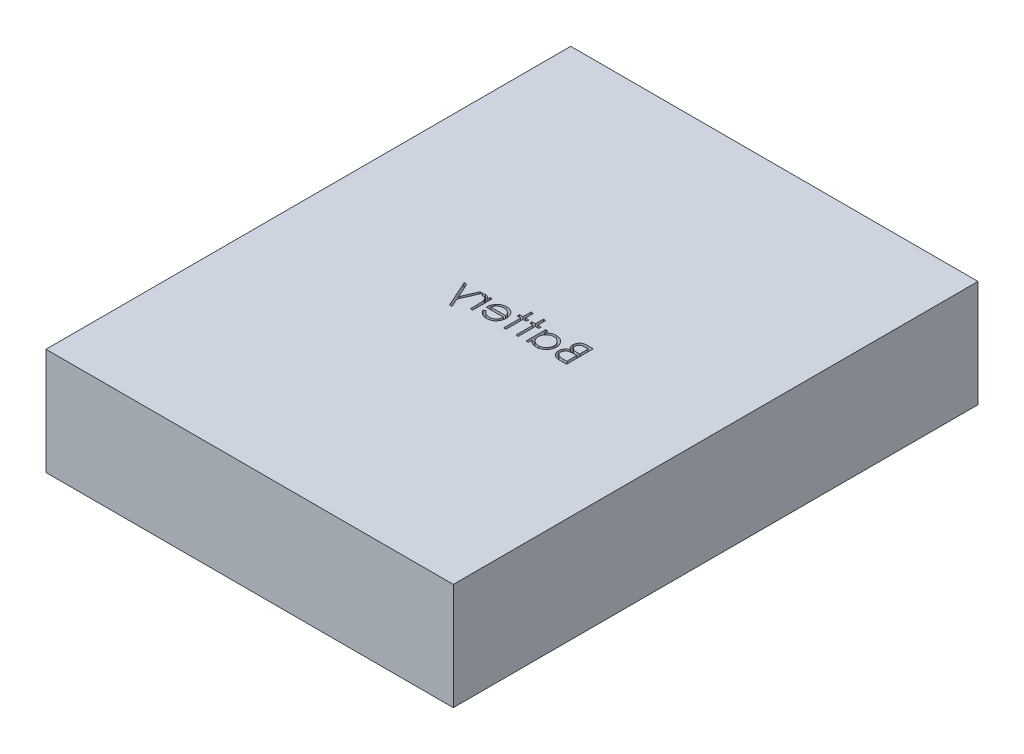
from build123d import *

# Parameters (mm, degrees)
SKETCH1_W           = 53.4
SKETCH1_H           = 68.8
BOSS_EXTRUDE1_DEPTH = 14
CUT_EXTRUDE8_DEPTH  = 15


with BuildPart() as part:
    # Sketch1 → Boss-Extrude1 (new body)
    with BuildSketch(Plane(origin=(0, 0, 0), x_dir=(1, 0, 0), z_dir=(0, 1, 0))):
        with Locations((26.7, 34.4)):
            Rectangle(SKETCH1_W, SKETCH1_H)
    extrude(amount=BOSS_EXTRUDE1_DEPTH)

    # Sketch10 → Cut-Extrude8 (cut, symmetric)
    # profile 1 of 7: a face of its own
    with BuildSketch(Plane(origin=(0, 0, 0), x_dir=(-1, 0, 0), z_dir=(0, -1, 0))):
        with BuildLine():
            Line((-35.827007514, 35.925623616), (-35.144114886, 35.925623616))
            add(Edge.make_bspline(
                [(-35.144114886, 35.925623616), (-35.110686407, 35.925447866), (-35.045893697, 35.925107218), (-34.951674255, 35.919824086), (-34.863425445, 35.912620417), (-34.781121672, 35.901190324), (-34.70480097, 35.887398547), (-34.634233333, 35.870696731), (-34.56964316, 35.850670117), (-34.492530424, 35.818823836), (-34.404609763, 35.771500667), (-34.30941137, 35.701572102), (-34.228007131, 35.616039639), (-34.157820814, 35.519556984), (-34.102019694, 35.413421212), (-34.061650397, 35.300162023), (-34.036092522, 35.181240281), (-34.033464087, 35.099597103), (-34.032135719, 35.058335956)],
                knots=[0, 0, 0, 0, 1.001505555, 1.941167018, 2.826882275, 3.653841531, 4.429895133, 5.150066043, 5.825578002, 6.45369114, 7.647487171, 8.808567382, 9.977351308, 11.170798116, 12.373658725, 13.556498008, 14.765093433, 16, 16, 16, 16], degree=3))
            add(Edge.make_bspline(
                [(-34.032135719, 35.058335956), (-34.033228937, 35.0196834), (-34.035377215, 34.943727483), (-34.055919974, 34.832633374), (-34.088080643, 34.726882155), (-34.132785892, 34.626859769), (-34.190887888, 34.534826156), (-34.259746207, 34.45003889), (-34.342823009, 34.376087833), (-34.405066249, 34.334744931), (-34.436682995, 34.31374461)],
                knots=[0, 0, 0, 0, 1.044552857, 2.05264487, 3.044412934, 4.028983338, 5.005914585, 5.980388656, 6.974128949, 8, 8, 8, 8], degree=3))
            add(Edge.make_bspline(
                [(-34.436682995, 34.31374461), (-34.396922567, 34.298479611), (-34.32085102, 34.269273886), (-34.216165007, 34.217638422), (-34.125970162, 34.161476312), (-34.049573016, 34.100144462), (-33.984235361, 34.034035651), (-33.92718242, 33.962180537), (-33.878501046, 33.883641779), (-33.836788122, 33.799238243), (-33.804239366, 33.709831775), (-33.779863462, 33.616260999), (-33.765896013, 33.518861444), (-33.763908371, 33.452576064), (-33.76290495, 33.419113199)],
                knots=[0, 0, 0, 0, 1.27268992, 2.434971085, 3.483601985, 4.442670788, 5.356604649, 6.2567628, 7.179492994, 8.113709626, 9.066344395, 10.018646069, 10.999752585, 12, 12, 12, 12], degree=3))
            add(Edge.make_bspline(
                [(-33.76290495, 33.419113199), (-33.763881796, 33.384946327), (-33.765803768, 33.317722049), (-33.77998374, 33.218966915), (-33.803992847, 33.124591968), (-33.837063993, 33.033986785), (-33.880226307, 32.947326651), (-33.932754272, 32.864513387), (-33.995385835, 32.786379056), (-34.065448704, 32.712055433), (-34.14471085, 32.645227646), (-34.230226605, 32.585711939), (-34.323072925, 32.536765877), (-34.421724919, 32.495649855), (-34.527289235, 32.464242657), (-34.639291842, 32.442270083), (-34.757636144, 32.427465046), (-34.838845895, 32.426247841), (-34.880493091, 32.425623616)],
                knots=[0, 0, 0, 0, 0.978564426, 1.925352924, 2.850884081, 3.763762016, 4.682927383, 5.618979971, 6.567305752, 7.547517671, 8.540179244, 9.531824382, 10.526200242, 11.540722885, 12.589160233, 13.674978461, 14.80764778, 16, 16, 16, 16], degree=3))
            Line((-34.880493091, 32.425623616), (-35.827007514, 32.425623616))
            Line((-35.827007514, 32.425623616), (-35.827007514, 35.925623616))
        make_face()
        with BuildLine():
            Line((-35.51290495, 35.566649257), (-35.51290495, 34.444854385))
            Line((-35.51290495, 34.444854385), (-35.30186729, 34.444854385))
            add(Edge.make_bspline(
                [(-35.30186729, 34.444854385), (-35.271018494, 34.445254308), (-35.211412335, 34.446027041), (-35.125092438, 34.448240558), (-35.04496742, 34.454438601), (-34.971175587, 34.460634863), (-34.903833143, 34.470709451), (-34.843089282, 34.482701574), (-34.787990685, 34.495384479), (-34.724451139, 34.516953966), (-34.652378191, 34.548831641), (-34.575545087, 34.598303477), (-34.507810617, 34.657227831), (-34.450613429, 34.725218792), (-34.403801959, 34.800084978), (-34.371288244, 34.880631859), (-34.349240959, 34.964851991), (-34.347249428, 35.022670243), (-34.346238283, 35.05202586)],
                knots=[0, 0, 0, 0, 1.156816544, 2.235205308, 3.236616184, 4.169592532, 5.011045266, 5.787822928, 6.49130361, 7.128639758, 8.301311294, 9.436451833, 10.541879658, 11.654887649, 12.756523258, 13.837046038, 14.901820046, 16, 16, 16, 16], degree=3))
            add(Edge.make_bspline(
                [(-34.346238283, 35.05202586), (-34.346764463, 35.071451631), (-34.347796623, 35.109557403), (-34.356249926, 35.165106757), (-34.3706175, 35.21735051), (-34.389071793, 35.26700462), (-34.414860482, 35.31251647), (-34.445223945, 35.355459666), (-34.481909636, 35.394371785), (-34.523666948, 35.430741283), (-34.571675571, 35.462985811), (-34.625906863, 35.491226574), (-34.68709454, 35.513967351), (-34.754207395, 35.533883503), (-34.828278483, 35.547871797), (-34.908453036, 35.559525184), (-34.995387755, 35.565457926), (-35.055532858, 35.566243289), (-35.086622899, 35.566649257)],
                knots=[0, 0, 0, 0, 0.91205012, 1.789085906, 2.630437955, 3.453916878, 4.269457761, 5.079663411, 5.91843418, 6.774407191, 7.675494373, 8.627863946, 9.638891023, 10.736472738, 11.911756761, 13.175263542, 14.539845004, 16, 16, 16, 16], degree=3))
            Line((-35.086622899, 35.566649257), (-35.51290495, 35.566649257))
        make_face(mode=Mode.SUBTRACT)
        with BuildLine():
            Line((-35.51290495, 34.085880026), (-35.51290495, 32.784597975))
            Line((-35.51290495, 32.784597975), (-35.065589245, 32.784597975))
            add(Edge.make_bspline(
                [(-35.065589245, 32.784597975), (-35.033570319, 32.784981722), (-34.97185806, 32.785721345), (-34.88275683, 32.788135899), (-34.800173726, 32.793628175), (-34.724485591, 32.802274025), (-34.654875138, 32.811652474), (-34.592177435, 32.824263755), (-34.535884241, 32.838712715), (-34.470609934, 32.861046888), (-34.397106425, 32.895743359), (-34.317895569, 32.948057585), (-34.247469351, 33.010380893), (-34.187664092, 33.082511807), (-34.138651103, 33.160943134), (-34.102995648, 33.244088484), (-34.081004791, 33.330574011), (-34.078342622, 33.389540724), (-34.077007514, 33.419113199)],
                knots=[0, 0, 0, 0, 1.160039823, 2.235823828, 3.228722157, 4.157150951, 4.99529583, 5.772374946, 6.472645482, 7.099169577, 8.269452708, 9.405989375, 10.527446681, 11.663510218, 12.788923519, 13.866172445, 14.929861265, 16, 16, 16, 16], degree=3))
            add(Edge.make_bspline(
                [(-34.077007514, 33.419113199), (-34.077283618, 33.43760654), (-34.077831373, 33.474294922), (-34.086091988, 33.528210741), (-34.098105858, 33.580436614), (-34.113637292, 33.631114355), (-34.136256759, 33.679327731), (-34.162663304, 33.72603029), (-34.193624706, 33.77128377), (-34.241868872, 33.828496023), (-34.312040856, 33.894413036), (-34.411747631, 33.958950539), (-34.525119929, 34.010998346), (-34.607347422, 34.033097822), (-34.64982402, 34.04451384)],
                knots=[0, 0, 0, 0, 0.723448775, 1.435228256, 2.130040452, 2.821711965, 3.505591119, 4.210454504, 4.921174351, 5.648778258, 7.137944449, 8.670945889, 10.280296675, 12, 12, 12, 12], degree=3))
            add(Edge.make_bspline(
                [(-34.64982402, 34.04451384), (-34.666853116, 34.047968924), (-34.703775708, 34.055460259), (-34.763983289, 34.063367962), (-34.832719158, 34.070413022), (-34.910142035, 34.07562418), (-34.996349876, 34.081010723), (-35.091526795, 34.083105545), (-35.19528411, 34.085604805), (-35.267276482, 34.085785939), (-35.304671777, 34.085880026)],
                knots=[0, 0, 0, 0, 0.634451884, 1.375622551, 2.216452059, 3.157844607, 4.20941857, 5.370758133, 6.634282058, 8, 8, 8, 8], degree=3))
            Line((-35.304671777, 34.085880026), (-35.51290495, 34.085880026))
        make_face(mode=Mode.SUBTRACT)
    # profile 2 of 7: a face of its own
    with BuildSketch(Plane(origin=(0, 0, 0), x_dir=(-1, 0, 0), z_dir=(0, -1, 0))):
        with BuildLine():
            Line((-30.532135719, 34.983315924), (-30.532135719, 32.425623616))
            Line((-30.532135719, 32.425623616), (-30.846238283, 32.425623616))
            Line((-30.846238283, 32.425623616), (-30.846238283, 32.868031469))
            add(Edge.make_bspline(
                [(-30.846238283, 32.868031469), (-30.881657074, 32.827991875), (-30.950777289, 32.749854103), (-31.066218407, 32.647771931), (-31.188586585, 32.563393609), (-31.317287906, 32.495243694), (-31.452206149, 32.444051637), (-31.593042237, 32.407665478), (-31.739853618, 32.384271643), (-31.840105972, 32.381935621), (-31.890909757, 32.380751821)],
                knots=[0, 0, 0, 0, 1.074387032, 2.096679803, 3.090159297, 4.057316773, 5.018401886, 5.985159533, 6.978961417, 8, 8, 8, 8], degree=3))
            add(Edge.make_bspline(
                [(-31.890909757, 32.380751821), (-31.936077711, 32.381978193), (-32.025150916, 32.384396654), (-32.156179993, 32.403158957), (-32.282272243, 32.433289579), (-32.403546815, 32.475190469), (-32.519218961, 32.53077129), (-32.630279058, 32.597312538), (-32.73615175, 32.676553368), (-32.835223289, 32.767141397), (-32.926455289, 32.865536384), (-33.006516562, 32.970481931), (-33.073269641, 33.081524235), (-33.129089722, 33.197257388), (-33.172086067, 33.318572308), (-33.202059701, 33.445049476), (-33.220800147, 33.576539349), (-33.223217608, 33.666078873), (-33.224443411, 33.711480988)],
                knots=[0, 0, 0, 0, 1.033919861, 2.038935746, 3.024066025, 3.998881131, 4.97069526, 5.957263378, 6.95902576, 7.993208707, 9.027059324, 10.027763471, 11.009749337, 11.988697705, 12.965288445, 13.950418724, 14.960734635, 16, 16, 16, 16], degree=3))
            add(Edge.make_bspline(
                [(-33.224443411, 33.711480988), (-33.22319044, 33.755944691), (-33.220713383, 33.843847035), (-33.202260163, 33.973125733), (-33.171229155, 34.097643993), (-33.127681307, 34.217000937), (-33.071839352, 34.331340987), (-33.003911265, 34.440745012), (-32.92389214, 34.545514409), (-32.831639733, 34.643185636), (-32.731704963, 34.73340625), (-32.624796232, 34.811815296), (-32.513572951, 34.879532145), (-32.39630994, 34.933185621), (-32.274742836, 34.976594725), (-32.14778939, 35.006627694), (-32.015977811, 35.024325015), (-31.926487319, 35.026887779), (-31.881094052, 35.028187719)],
                knots=[0, 0, 0, 0, 1.020392517, 2.01726096, 2.990465484, 3.961182959, 4.928053699, 5.906110375, 6.912531644, 7.948652711, 8.985773172, 9.998621852, 10.987621588, 11.969261332, 12.953316658, 13.946091881, 14.958173133, 16, 16, 16, 16], degree=3))
            add(Edge.make_bspline(
                [(-31.881094052, 35.028187719), (-31.828894193, 35.026749967), (-31.726532733, 35.023930604), (-31.576804724, 35.000467877), (-31.435160246, 34.96082941), (-31.300505894, 34.906911912), (-31.173325208, 34.835263182), (-31.054822224, 34.744883221), (-30.94375674, 34.636342034), (-30.879376449, 34.55297159), (-30.846238283, 34.510058712)],
                knots=[0, 0, 0, 0, 1.038897134, 2.037228247, 3.008116434, 3.962042015, 4.918381754, 5.904844433, 6.921570401, 8, 8, 8, 8], degree=3))
            Line((-30.846238283, 34.510058712), (-30.846238283, 34.983315924))
            Line((-30.846238283, 34.983315924), (-30.532135719, 34.983315924))
        make_face()
        with BuildLine():
            add(Edge.make_bspline(
                [(-31.876887322, 34.714085154), (-31.922801659, 34.712451517), (-32.013429259, 34.709226976), (-32.146473261, 34.68405348), (-32.273786676, 34.642168886), (-32.39473275, 34.584886985), (-32.507400966, 34.512858248), (-32.608094637, 34.425736865), (-32.697637339, 34.325899851), (-32.772945603, 34.21379774), (-32.8343361, 34.093619649), (-32.877503132, 33.967995211), (-32.905972379, 33.839190234), (-32.9088809, 33.751827548), (-32.910340847, 33.707975379)],
                knots=[0, 0, 0, 0, 1.031046209, 2.035121221, 3.029706178, 4.034933723, 5.034054252, 6.02443088, 7.017295772, 8.038157696, 9.050218397, 10.03989886, 11.016116709, 12, 12, 12, 12], degree=3))
            add(Edge.make_bspline(
                [(-32.910340847, 33.707975379), (-32.908475954, 33.664385272), (-32.904753477, 33.577375916), (-32.878002783, 33.448395339), (-32.833122909, 33.322741297), (-32.771880846, 33.201480303), (-32.695194222, 33.088896203), (-32.606305569, 32.98715608), (-32.504355288, 32.899666492), (-32.391427781, 32.826428919), (-32.27081981, 32.767266398), (-32.143985879, 32.726100758), (-32.013310241, 32.699522978), (-31.924457907, 32.696418501), (-31.879691809, 32.694854385)],
                knots=[0, 0, 0, 0, 0.979072187, 1.954306742, 2.945804271, 3.96968567, 4.997920485, 5.998718438, 6.996577872, 8.005894225, 9.015743152, 10.005417472, 10.995077863, 12, 12, 12, 12], degree=3))
            add(Edge.make_bspline(
                [(-31.879691809, 32.694854385), (-31.834245306, 32.696514349), (-31.743856719, 32.699815853), (-31.610418012, 32.725097118), (-31.480923049, 32.766865916), (-31.35713582, 32.824765043), (-31.241819689, 32.896522399), (-31.138321812, 32.98052949), (-31.050805843, 33.078232674), (-30.976613234, 33.185609127), (-30.918437817, 33.303321124), (-30.876061758, 33.428655314), (-30.851007852, 33.561616063), (-30.847850122, 33.65247999), (-30.846238283, 33.698860795)],
                knots=[0, 0, 0, 0, 1.01762866, 2.023962475, 3.030623092, 4.058876274, 5.077231937, 6.066672613, 7.034107872, 8.005628644, 8.981990164, 9.965428785, 10.961468474, 12, 12, 12, 12], degree=3))
            add(Edge.make_bspline(
                [(-30.846238283, 33.698860795), (-30.847197939, 33.734198626), (-30.849086847, 33.803754659), (-30.863517416, 33.905882177), (-30.886472343, 34.003615903), (-30.918818513, 34.097058592), (-30.961309797, 34.185693607), (-31.012557563, 34.270157368), (-31.073463013, 34.350010579), (-31.143045709, 34.42415365), (-31.219210912, 34.491780112), (-31.299805452, 34.552144353), (-31.385784199, 34.601733126), (-31.475701236, 34.642774397), (-31.569712571, 34.675433547), (-31.66858319, 34.697221241), (-31.771262177, 34.712181562), (-31.841308233, 34.713443943), (-31.876887322, 34.714085154)],
                knots=[0, 0, 0, 0, 1.050140795, 2.067009409, 3.05949893, 4.030605086, 5.00011959, 5.97591094, 6.962425594, 7.979863591, 8.993523472, 9.986985069, 10.967611495, 11.937549037, 12.921786183, 13.919465291, 14.943216303, 16, 16, 16, 16], degree=3))
        make_face(mode=Mode.SUBTRACT)
    # profile 3 of 7: a face of its own
    with BuildSketch(Plane(origin=(0, 0, 0), x_dir=(-1, 0, 0), z_dir=(0, -1, 0))):
        Polygon((-29.500084437, 36.015367206), (-29.185981873, 36.015367206), (-29.185981873, 34.983315924), (-28.737263924, 34.983315924), (-28.737263924, 34.66921336), (-29.185981873, 34.66921336), (-29.185981873, 32.425623616), (-29.500084437, 32.425623616), (-29.500084437, 34.66921336), (-29.948802386, 34.66921336), (-29.948802386, 34.983315924), (-29.500084437, 34.983315924), align=None)
    # profile 4 of 7: a face of its own
    with BuildSketch(Plane(origin=(0, 0, 0), x_dir=(-1, 0, 0), z_dir=(0, -1, 0))):
        Polygon((-27.884699822, 36.015367206), (-27.570597257, 36.015367206), (-27.570597257, 34.983315924), (-27.121879309, 34.983315924), (-27.121879309, 34.66921336), (-27.570597257, 34.66921336), (-27.570597257, 32.425623616), (-27.884699822, 32.425623616), (-27.884699822, 34.66921336), (-28.33341777, 34.66921336), (-28.33341777, 34.983315924), (-27.884699822, 34.983315924), align=None)
    # profile 5 of 7: a face of its own
    with BuildSketch(Plane(origin=(0, 0, 0), x_dir=(-1, 0, 0), z_dir=(0, -1, 0))):
        with BuildLine():
            Line((-24.484259116, 33.233315924), (-24.205212642, 33.086781469))
            add(Edge.make_bspline(
                [(-24.205212642, 33.086781469), (-24.227449237, 33.047338137), (-24.270712846, 32.970597034), (-24.345113594, 32.865165174), (-24.423105666, 32.770317458), (-24.508209634, 32.688587804), (-24.597879313, 32.617336419), (-24.692611968, 32.554998594), (-24.792900786, 32.501880074), (-24.898750511, 32.457127546), (-25.011050062, 32.422718052), (-25.130071578, 32.398413831), (-25.256043073, 32.383390562), (-25.342389253, 32.381645421), (-25.386602866, 32.380751821)],
                knots=[0, 0, 0, 0, 1.120438281, 2.179929193, 3.190490725, 4.156257408, 5.095198341, 6.022838206, 6.959905092, 7.901321166, 8.864066838, 9.862729781, 10.905609505, 12, 12, 12, 12], degree=3))
            add(Edge.make_bspline(
                [(-25.386602866, 32.380751821), (-25.435744844, 32.381898996), (-25.531606606, 32.384136803), (-25.671146353, 32.403429268), (-25.802525771, 32.434901626), (-25.925737475, 32.478867168), (-26.040479727, 32.536294492), (-26.146980582, 32.606253974), (-26.245800108, 32.688386228), (-26.333824317, 32.783402672), (-26.4130682, 32.885084629), (-26.48299402, 32.991040514), (-26.541451451, 33.101003738), (-26.589004061, 33.214274262), (-26.627408926, 33.330138156), (-26.65417563, 33.449649623), (-26.669605378, 33.572485207), (-26.671969823, 33.655582543), (-26.67316136, 33.697458552)],
                knots=[0, 0, 0, 0, 1.145258523, 2.234067595, 3.276747158, 4.290159414, 5.277019952, 6.260822364, 7.254936242, 8.264827045, 9.274100331, 10.257902744, 11.220704747, 12.172965371, 13.118907548, 14.062713208, 15.023725156, 16, 16, 16, 16], degree=3))
            add(Edge.make_bspline(
                [(-26.67316136, 33.697458552), (-26.672102219, 33.736753382), (-26.67000314, 33.814630547), (-26.656772353, 33.929896091), (-26.63332406, 34.041924544), (-26.601147736, 34.150808992), (-26.55959649, 34.256367126), (-26.508764271, 34.35866319), (-26.448571893, 34.457588329), (-26.402099219, 34.519991463), (-26.378690206, 34.551424898)],
                knots=[0, 0, 0, 0, 1.024358464, 2.0301432, 3.019427413, 4.004406732, 4.986367066, 5.972626655, 6.978780325, 8, 8, 8, 8], degree=3))
            add(Edge.make_bspline(
                [(-26.378690206, 34.551424898), (-26.346982523, 34.589293768), (-26.284571577, 34.663831919), (-26.179015221, 34.761770244), (-26.064715025, 34.84381402), (-25.943103399, 34.911821156), (-25.812766925, 34.963494803), (-25.675457634, 35.002002385), (-25.529612048, 35.023580396), (-25.429906827, 35.02662823), (-25.378890527, 35.028187719)],
                knots=[0, 0, 0, 0, 1.030682036, 2.02871468, 2.997146059, 3.962720338, 4.930598197, 5.918074684, 6.934738563, 8, 8, 8, 8], degree=3))
            add(Edge.make_bspline(
                [(-25.378890527, 35.028187719), (-25.326442921, 35.02683367), (-25.223552675, 35.024177334), (-25.073520554, 34.999551001), (-24.931559838, 34.960498446), (-24.797727334, 34.905344656), (-24.672009473, 34.834185104), (-24.555223423, 34.746043263), (-24.445371911, 34.643625175), (-24.381463332, 34.564861966), (-24.34894261, 34.52478227)],
                knots=[0, 0, 0, 0, 1.056321875, 2.072262726, 3.055038591, 4.01806755, 4.982017516, 5.957941055, 6.960871419, 8, 8, 8, 8], degree=3))
            add(Edge.make_bspline(
                [(-24.34894261, 34.52478227), (-24.326815672, 34.494578688), (-24.282709079, 34.43437257), (-24.227461979, 34.336201413), (-24.179504584, 34.233490818), (-24.141171623, 34.124580521), (-24.110132121, 34.010760941), (-24.087675303, 33.891218396), (-24.074505684, 33.765988485), (-24.071916987, 33.680661929), (-24.070597257, 33.637162077)],
                knots=[0, 0, 0, 0, 0.94817472, 1.890038105, 2.849395472, 3.817997239, 4.812318967, 5.836947057, 6.897266129, 8, 8, 8, 8], degree=3))
            Line((-24.070597257, 33.637162077), (-26.359058796, 33.637162077))
            add(Edge.make_bspline(
                [(-26.359058796, 33.637162077), (-26.35751919, 33.603461613), (-26.354491616, 33.537191009), (-26.340376472, 33.440220226), (-26.318127699, 33.347846884), (-26.286858636, 33.260763842), (-26.248991791, 33.177833715), (-26.202606074, 33.099671678), (-26.14726652, 33.026633748), (-26.085540821, 32.95806661), (-26.016833725, 32.897005849), (-25.944550978, 32.842354073), (-25.867657413, 32.796548476), (-25.78675933, 32.759368586), (-25.701987544, 32.73026227), (-25.613315349, 32.71039445), (-25.520917233, 32.697087343), (-25.457931499, 32.695607677), (-25.425865687, 32.694854385)],
                knots=[0, 0, 0, 0, 1.094153842, 2.151609401, 3.174256925, 4.172055639, 5.149267565, 6.128595816, 7.11444997, 8.118368179, 9.117203808, 10.09244225, 11.054858984, 12.015122123, 12.976791628, 13.957293641, 14.960065497, 16, 16, 16, 16], degree=3))
            add(Edge.make_bspline(
                [(-25.425865687, 32.694854385), (-25.394514539, 32.695462442), (-25.332307848, 32.696668943), (-25.239666991, 32.708400854), (-25.148527464, 32.727371129), (-25.05926648, 32.75326112), (-24.973695635, 32.784837972), (-24.894450084, 32.822940829), (-24.821569869, 32.865090576), (-24.753452902, 32.913300251), (-24.687381909, 32.972308438), (-24.621839422, 33.045944159), (-24.551562769, 33.133031687), (-24.507573176, 33.198577353), (-24.484259116, 33.233315924)],
                knots=[0, 0, 0, 0, 0.99110716, 1.966546729, 2.947904876, 3.932708344, 4.903319531, 5.828989031, 6.710028674, 7.56322171, 8.463672341, 9.504779593, 10.677557249, 12, 12, 12, 12], degree=3))
        make_face()
        with BuildLine():
            add(Edge.make_bspline(
                [(-24.384699822, 33.951264642), (-24.396196446, 33.992927515), (-24.418323748, 34.073115136), (-24.464560112, 34.184156026), (-24.516631653, 34.282843927), (-24.578253384, 34.36842356), (-24.64807211, 34.444427073), (-24.728717292, 34.510845659), (-24.819153186, 34.57026311), (-24.918912327, 34.620415609), (-25.024554112, 34.663105468), (-25.135160304, 34.691730584), (-25.248018091, 34.711340126), (-25.324352378, 34.713166234), (-25.362764725, 34.714085154)],
                knots=[0, 0, 0, 0, 1.154881502, 2.222775134, 3.210006277, 4.132804581, 5.035138423, 5.962687519, 6.919655026, 7.923214229, 8.944639381, 9.960483929, 10.97369054, 12, 12, 12, 12], degree=3))
            add(Edge.make_bspline(
                [(-25.362764725, 34.714085154), (-25.394114164, 34.713473483), (-25.456085413, 34.712264337), (-25.547386481, 34.700794207), (-25.63506618, 34.681834363), (-25.719771468, 34.655869406), (-25.800392336, 34.621260804), (-25.878587104, 34.580677577), (-25.952367501, 34.531135993), (-25.998508796, 34.493377138), (-26.021819213, 34.474301501)],
                knots=[0, 0, 0, 0, 1.04873581, 2.073130211, 3.073294108, 4.04793562, 5.032784715, 6.005352987, 6.992311501, 8, 8, 8, 8], degree=3))
            add(Edge.make_bspline(
                [(-26.021819213, 34.474301501), (-26.038512495, 34.459207185), (-26.072295629, 34.428659969), (-26.11743615, 34.376030762), (-26.160656623, 34.3192792), (-26.199990276, 34.256234076), (-26.236067862, 34.187613297), (-26.269827839, 34.113995661), (-26.300214251, 34.034822531), (-26.317310361, 33.979650092), (-26.326106072, 33.951264642)],
                knots=[0, 0, 0, 0, 0.879870761, 1.780643979, 2.707998968, 3.669668524, 4.684282772, 5.740141944, 6.837334558, 8, 8, 8, 8], degree=3))
            Line((-26.326106072, 33.951264642), (-24.384699822, 33.951264642))
        make_face(mode=Mode.SUBTRACT)
    # profile 6 of 7: a face of its own
    with BuildSketch(Plane(origin=(0, 0, 0), x_dir=(-1, 0, 0), z_dir=(0, -1, 0))):
        with BuildLine():
            Line((-23.532135719, 34.983315924), (-23.218033155, 34.983315924))
            Line((-23.218033155, 34.983315924), (-23.218033155, 34.60681352))
            add(Edge.make_bspline(
                [(-23.218033155, 34.60681352), (-23.194844396, 34.641869348), (-23.150496075, 34.708913347), (-23.076783146, 34.797582648), (-23.001279815, 34.870997695), (-22.923624627, 34.929501214), (-22.843246527, 34.973314333), (-22.761909576, 35.005407368), (-22.678334106, 35.024384683), (-22.622172182, 35.026918342), (-22.594034757, 35.028187719)],
                knots=[0, 0, 0, 0, 1.2804753, 2.448899062, 3.506932113, 4.484331642, 5.4025378, 6.288909075, 7.142734305, 8, 8, 8, 8], degree=3))
            add(Edge.make_bspline(
                [(-22.594034757, 35.028187719), (-22.572208431, 35.026997192), (-22.527299346, 35.024547606), (-22.459316756, 35.007336781), (-22.389273304, 34.979858759), (-22.344130917, 34.954018536), (-22.320597257, 34.940547494)],
                knots=[0, 0, 0, 0, 0.901110191, 1.854092781, 2.881294221, 4, 4, 4, 4], degree=3))
            Line((-22.320597257, 34.940547494), (-22.493073219, 34.668512238))
            add(Edge.make_bspline(
                [(-22.493073219, 34.668512238), (-22.50818224, 34.675252504), (-22.536862055, 34.688046819), (-22.578816621, 34.703188829), (-22.617497958, 34.712104745), (-22.642141516, 34.713455463), (-22.65363011, 34.714085154)],
                knots=[0, 0, 0, 0, 1.180555205, 2.24091978, 3.179933427, 4, 4, 4, 4], degree=3))
            add(Edge.make_bspline(
                [(-22.65363011, 34.714085154), (-22.678835844, 34.712405117), (-22.730248234, 34.708978328), (-22.805732733, 34.68203952), (-22.878979938, 34.63851428), (-22.937151601, 34.590243168), (-22.982193854, 34.543695371), (-23.014334079, 34.503046968), (-23.043816826, 34.457468337), (-23.071987047, 34.407738653), (-23.097653341, 34.353008807), (-23.12160801, 34.293825593), (-23.143266873, 34.230120464), (-23.155617117, 34.185737944), (-23.161943411, 34.163003424)],
                knots=[0, 0, 0, 0, 1.125678352, 2.296057538, 3.5422874, 4.923748041, 5.663163013, 6.437101912, 7.23742474, 8.08941207, 8.991984279, 9.93940061, 10.944477711, 12, 12, 12, 12], degree=3))
            add(Edge.make_bspline(
                [(-23.161943411, 34.163003424), (-23.166675805, 34.14272625), (-23.177157696, 34.097813851), (-23.187349234, 34.022465327), (-23.197418752, 33.933441668), (-23.204515371, 33.830495075), (-23.211093413, 33.713882631), (-23.214803495, 33.583426686), (-23.217906635, 33.438993334), (-23.217989702, 33.338018981), (-23.218033155, 33.285198936)],
                knots=[0, 0, 0, 0, 0.566838948, 1.255505196, 2.06880316, 3.007127437, 4.065329342, 5.249902469, 6.561414163, 8, 8, 8, 8], degree=3))
            Line((-23.218033155, 33.285198936), (-23.218033155, 32.425623616))
            Line((-23.218033155, 32.425623616), (-23.532135719, 32.425623616))
            Line((-23.532135719, 32.425623616), (-23.532135719, 34.983315924))
        make_face()
    # profile 7 of 7: a face of its own
    with BuildSketch(Plane(origin=(0, 0, 0), x_dir=(-1, 0, 0), z_dir=(0, -1, 0))):
        Polygon((-22.275725463, 34.983315924), (-21.937083636, 34.983315924), (-21.071198219, 33.024381629), (-20.191991488, 34.983315924), (-19.85264854, 34.983315924), (-21.42316136, 31.483315924), (-21.762504309, 31.483315924), (-21.241570815, 32.643672494), align=None)
    extrude(amount=CUT_EXTRUDE8_DEPTH, both=True, mode=Mode.SUBTRACT)


with BuildPart() as cut_extrude8_piece_1:
    # of the separate pieces the step leaves, piece 1, a body of its own (cut_extrude8_pieces)
    add(part.part.solids().sort_by_distance((0, 0, 0))[0])


with BuildPart() as cut_extrude8_piece_2:
    # of the separate pieces the step leaves, piece 2, a body of its own (cut_extrude8_pieces)
    add(part.part.solids().sort_by_distance((30.846238283, 0, -33.698860795))[0])


with BuildPart() as cut_extrude8_piece_3:
    # of the separate pieces the step leaves, piece 3, a body of its own (cut_extrude8_pieces)
    add(part.part.solids().sort_by_distance((34.64982402, 0, -34.04451384))[0])


with BuildPart() as cut_extrude8_piece_4:
    # of the separate pieces the step leaves, piece 4, a body of its own (cut_extrude8_pieces)
    add(part.part.solids().sort_by_distance((34.346238283, 0, -35.05202586))[0])


with BuildPart() as cut_extrude8_piece_5:
    # of the separate pieces the step leaves, piece 5, a body of its own (cut_extrude8_pieces)
    add(part.part.solids().sort_by_distance((24.384699822, 0, -33.951264642))[0])


solid = Compound([cut_extrude8_piece_1.part, cut_extrude8_piece_2.part, cut_extrude8_piece_3.part, cut_extrude8_piece_4.part, cut_extrude8_piece_5.part])
